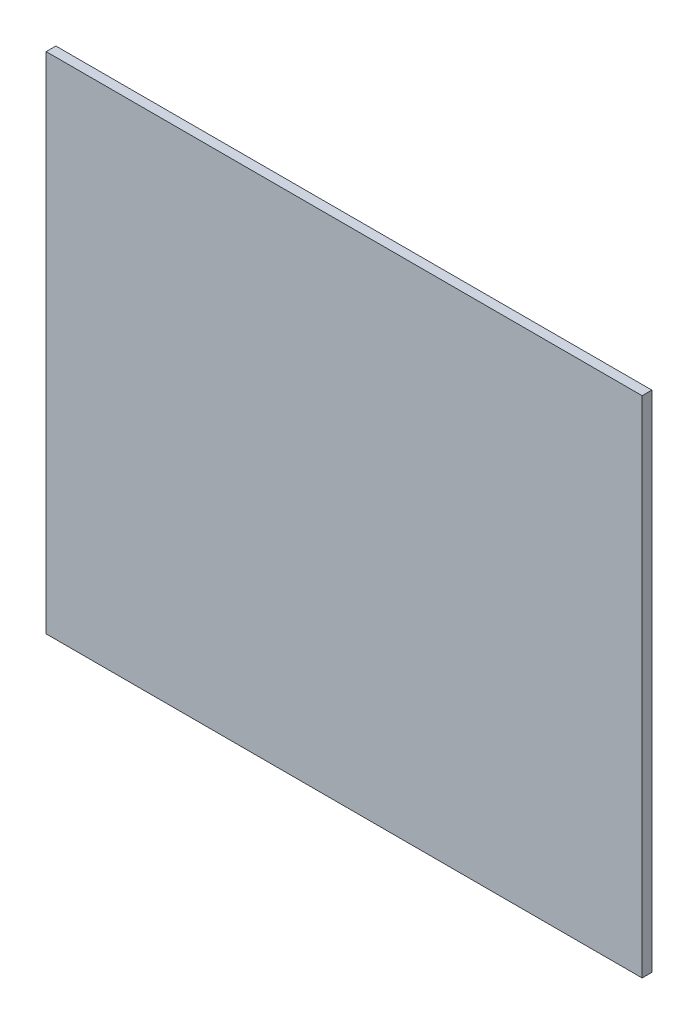
from build123d import *

# Parameters (mm, degrees)
SKETCH1_W           = 390
SKETCH1_H           = 330
BOSS_EXTRUDE1_DEPTH = 6.35


with BuildPart() as part:
    # Sketch1 → Boss-Extrude1 (new body)
    with BuildSketch(Plane.XY):
        with Locations((195, 165)):
            Rectangle(SKETCH1_W, SKETCH1_H)
    extrude(amount=BOSS_EXTRUDE1_DEPTH)


solid = part.part
